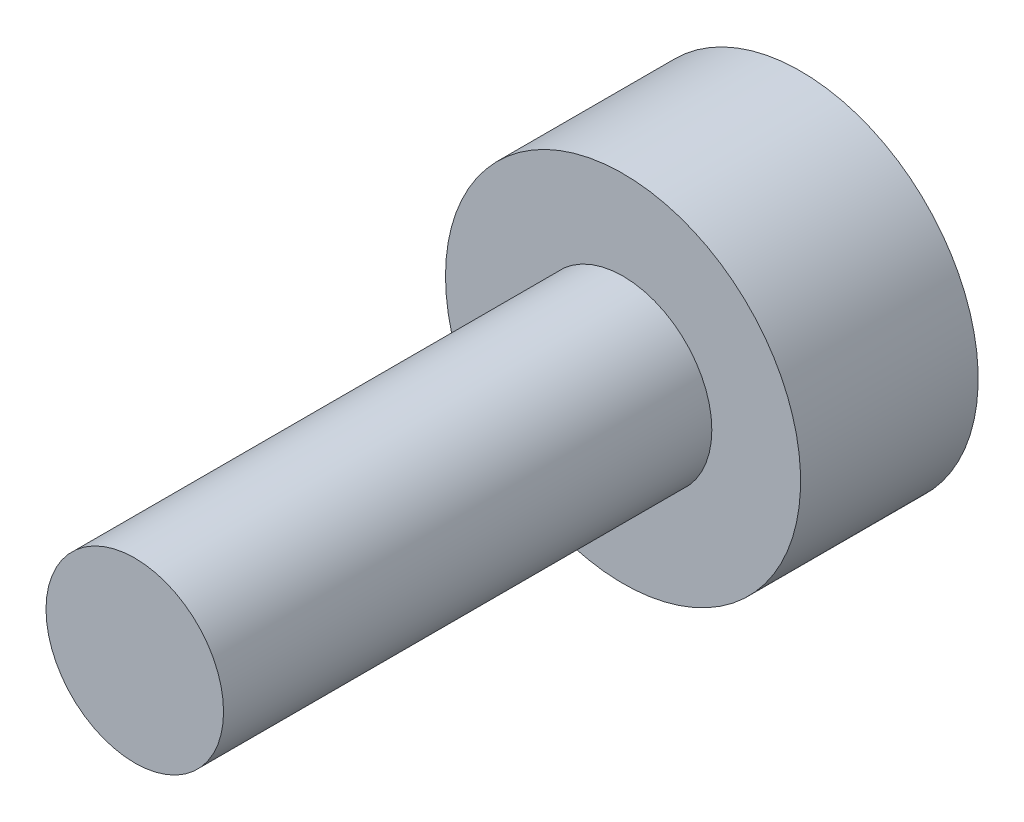
from build123d import *

# Parameters (mm, degrees)
SKETCH_1_R          = 1
EXTRUDE_1_DEPTH     = 5.5
SKETCH_2_R          = 2
EXTRUDE_2_DEPTH     = 2
CUT_EXTRUDE_1_DEPTH = 1


with BuildPart() as part:
    # 草图1 → 凸台-拉伸1 (new body)
    with BuildSketch(Plane.XY):
        Circle(SKETCH_1_R)
    extrude(amount=EXTRUDE_1_DEPTH)

    # 草图2 → 凸台-拉伸2 (add)
    with BuildSketch(Plane(origin=(0, 0, 0), x_dir=(-1, 0, 0), z_dir=(0, 0, -1))):
        Circle(SKETCH_2_R)
    extrude(amount=EXTRUDE_2_DEPTH)

    # 草图3 → 切除-拉伸1 (cut)
    with BuildSketch(Plane(origin=(0, 0, -2), x_dir=(-1, 0, 0), z_dir=(0, 0, -1))):
        Polygon((1, 0), (0.5, 0.866025404), (-0.5, 0.866025404), (-1, 0), (-0.5, -0.866025404), (0.5, -0.866025404), align=None)
    extrude(amount=-CUT_EXTRUDE_1_DEPTH, mode=Mode.SUBTRACT)


solid = part.part
